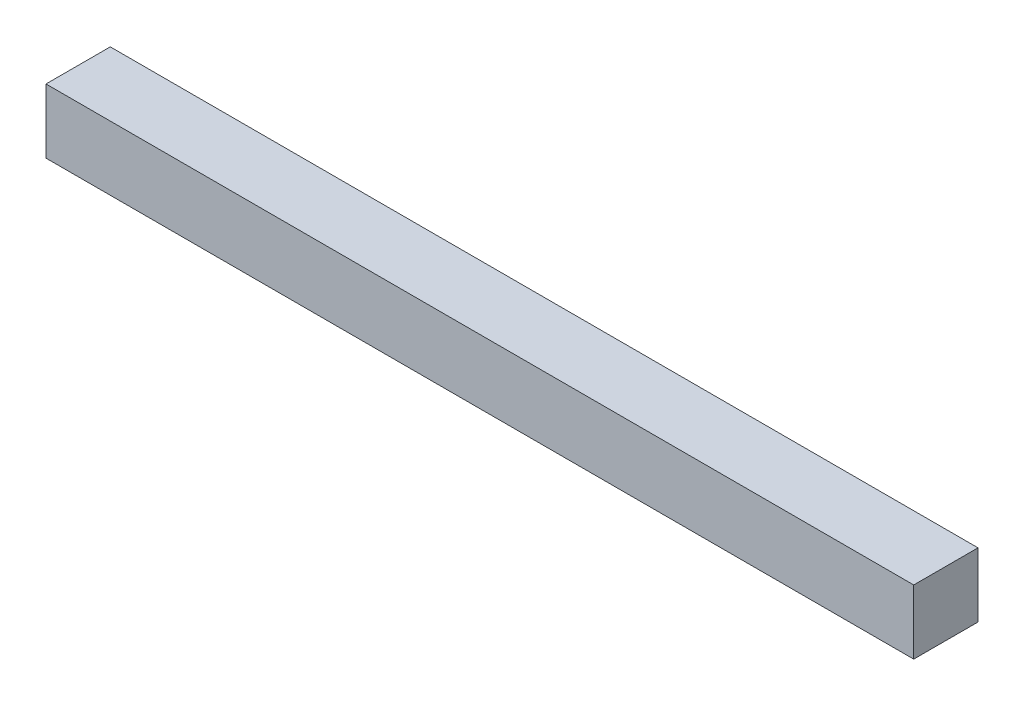
from build123d import *

# Parameters (mm, degrees)
SKETCH_1_W      = 20
SKETCH_1_H      = 20
EXTRUDE_1_DEPTH = 270


with BuildPart() as part:
    # 草图1 → 凸台-拉伸1 (new body)
    with BuildSketch(Plane(origin=(0, 0, 0), x_dir=(0, 0, -1), z_dir=(1, 0, 0))):
        Rectangle(SKETCH_1_W, SKETCH_1_H)
    extrude(amount=EXTRUDE_1_DEPTH)


solid = part.part
